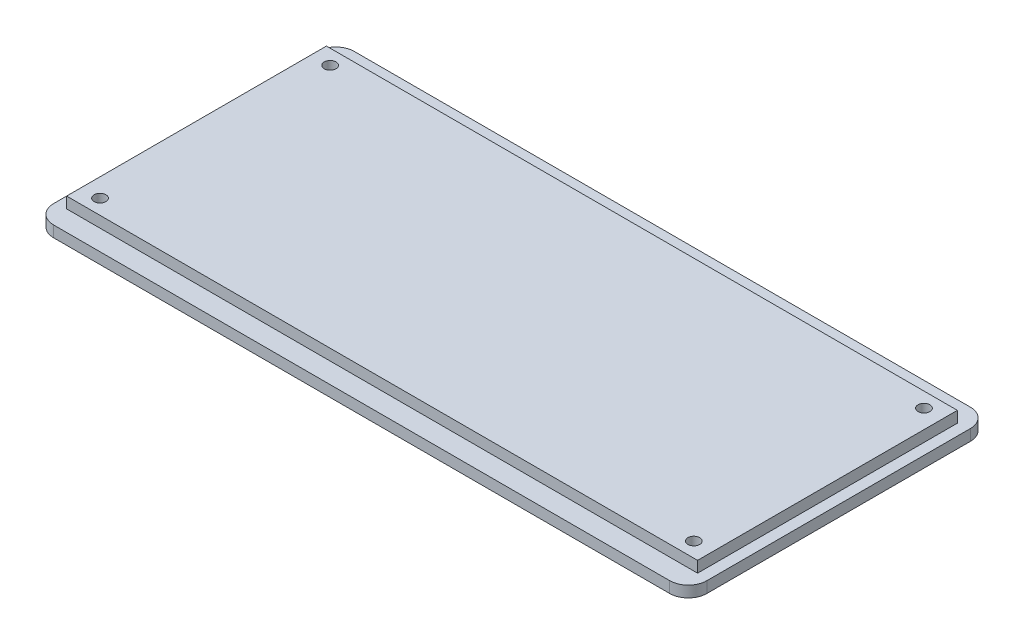
from build123d import *

# Parameters (mm, degrees)
SKETCH1_W               = 176
SKETCH1_H               = 81
BOSS_EXTRUDE1_DEPTH     = 3
FILLET1_R               = 5
SKETCH2_W               = 170
SKETCH2_H               = 70
BOSS_EXTRUDE2_DEPTH     = 6
SKETCH3_R               = 1.6
CUT_EXTRUDE1_DEPTH      = 98.057972367
SKETCH5_R               = 3
CUT_EXTRUDE5_DEPTH      = 2
MIRROR2_COPY_1_SKETCH_R = 1.6
MIRROR2_COPY_1_DEPTH    = 98.057972367
MIRROR2_COPY_2_SKETCH_R = 3
MIRROR2_COPY_2_DEPTH    = 2


with BuildPart() as part:
    # Sketch1 → Boss-Extrude1 (new body)
    with BuildSketch(Plane(origin=(0, 0, 0), x_dir=(1, 0, 0), z_dir=(0, 1, 0))):
        Rectangle(SKETCH1_W, SKETCH1_H)
    extrude(amount=BOSS_EXTRUDE1_DEPTH)

    # Fillet1
    fillet1_edges = [part.edges().sort_by_distance(p)[0] for p in [
        (-88, 1.5, -40.5),
        (-88, 1.5, 40.5),
        (88, 1.5, 40.5),
        (88, 1.5, -40.5),
    ]]
    fillet(fillet1_edges, radius=FILLET1_R)

    # Sketch2 → Boss-Extrude2 (add)
    with BuildSketch(Plane.XZ):
        Rectangle(SKETCH2_W, SKETCH2_H)
    extrude(amount=-BOSS_EXTRUDE2_DEPTH)

    # Sketch3 → Cut-Extrude1 (cut, through all)
    with BuildSketch(Plane(origin=(0, 6, 0), x_dir=(1, 0, 0), z_dir=(0, 1, 0))):
        with Locations(Location((-80, 31, 0), (0, 0, 270))):
            Circle(SKETCH3_R)
    cut_extrude1 = extrude(amount=-CUT_EXTRUDE1_DEPTH, mode=Mode.SUBTRACT)

    # Sketch5 → Cut-Extrude5 (cut)
    with BuildSketch(Plane.XZ):
        with Locations(Location((-80, -31, 0), (0, 0, 270))):
            Circle(SKETCH5_R)
    cut_extrude5 = extrude(amount=-CUT_EXTRUDE5_DEPTH, mode=Mode.SUBTRACT)

    # Mirror1: Cut-Extrude1, Cut-Extrude5 across plane
    add(cut_extrude1.mirror(Plane.XY), mode=Mode.SUBTRACT)
    add(cut_extrude5.mirror(Plane.XY), mode=Mode.SUBTRACT)

    # Mirror2: Cut-Extrude1, Cut-Extrude5 across plane
    add(cut_extrude1.mirror(Plane(origin=(0, 0, 0), x_dir=(0, 0, 1), z_dir=(1, 0, 0))), mode=Mode.SUBTRACT)
    add(cut_extrude5.mirror(Plane(origin=(0, 0, 0), x_dir=(0, 0, 1), z_dir=(1, 0, 0))), mode=Mode.SUBTRACT)

    # Mirror2 copy 1 sketch → Mirror2 copy 1 (cut, through all)
    with BuildSketch(Plane(origin=(0, 6, 0), x_dir=(-1, 0, 0), z_dir=(0, 1, 0))):
        with Locations(Location((-80, 31, 0), (0, 0, 270))):
            Circle(MIRROR2_COPY_1_SKETCH_R)
    extrude(amount=-MIRROR2_COPY_1_DEPTH, mode=Mode.SUBTRACT)

    # Mirror2 copy 2 sketch → Mirror2 copy 2 (cut)
    with BuildSketch(Plane(origin=(0, 0, 0), x_dir=(-1, 0, 0), z_dir=(0, -1, 0))):
        with Locations(Location((-80, -31, 0), (0, 0, 270))):
            Circle(MIRROR2_COPY_2_SKETCH_R)
    extrude(amount=-MIRROR2_COPY_2_DEPTH, mode=Mode.SUBTRACT)


solid = part.part
